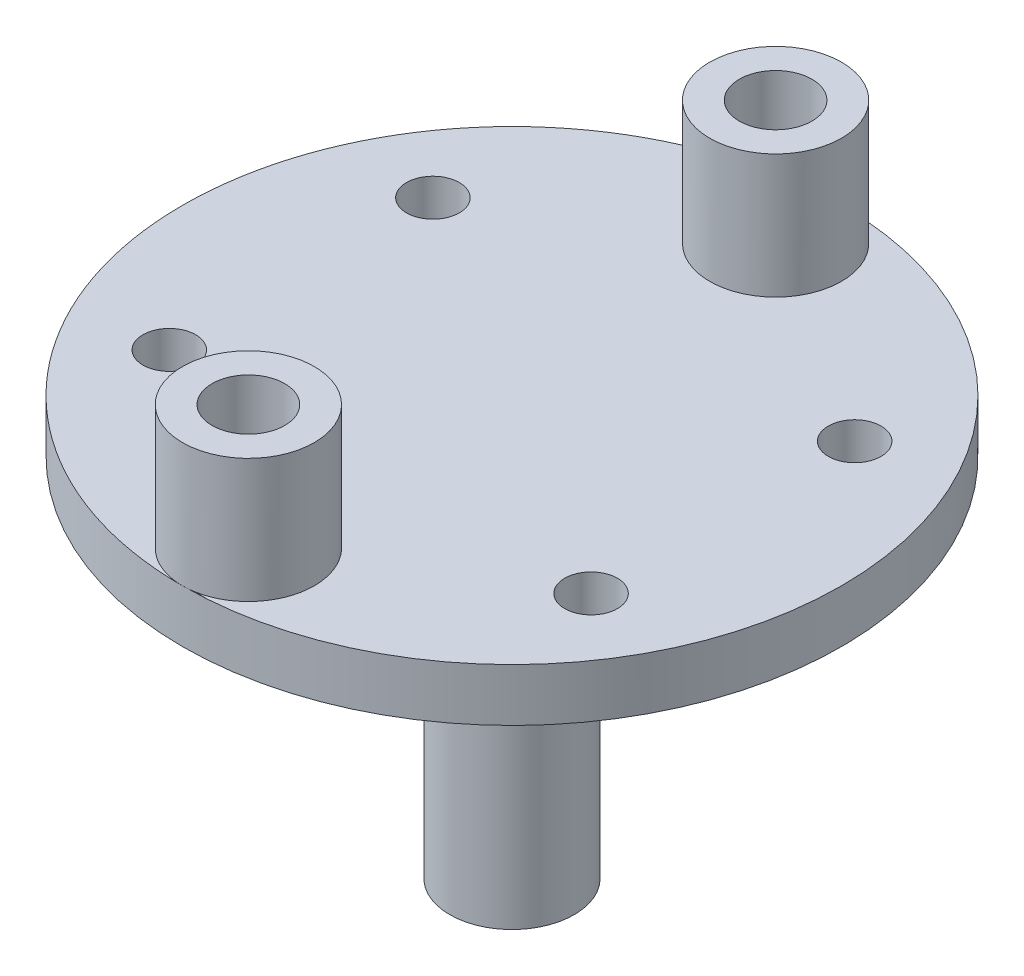
from build123d import *

# Parameters (mm, degrees)
SKETCH1_R           = 15.875
SKETCH1_R_2         = 1.75
SKETCH1_W           = 25.4
SKETCH1_H           = 17.78
SKETCH1_R_3         = 1.27
BOSS_EXTRUDE1_DEPTH = 2.54
SKETCH2_R           = 3.175
SKETCH2_R_2         = 1.75
BOSS_EXTRUDE2_DEPTH = 5.974999988
SKETCH3_R           = 3
BOSS_EXTRUDE3_DEPTH = 17.61998


with BuildPart() as part:
    # Sketch1 → Boss-Extrude1 (new body)
    # profile 1 of 2: a face of its own
    with BuildSketch(Plane(origin=(0, 0, 0), x_dir=(1, 0, 0), z_dir=(0, 1, 0))):
        with Locations(Location((12.7, 8.89, 0), (0, 0, 270))):
            Circle(SKETCH1_R)
        with Locations(Location((12.7, 21.59, 0), (0, 0, 270))):
            Circle(SKETCH1_R_2, mode=Mode.SUBTRACT)
        with Locations(Location((12.7, -3.81, 0), (0, 0, 270))):
            Circle(SKETCH1_R_2, mode=Mode.SUBTRACT)
        with Locations((12.7, 8.89)):
            Rectangle(SKETCH1_W, SKETCH1_H, mode=Mode.SUBTRACT)
    # profile 2 of 2: a face of its own
    with BuildSketch(Plane(origin=(0, 0, 0), x_dir=(1, 0, 0), z_dir=(0, 1, 0))):
        with Locations((12.7, 8.89)):
            Rectangle(SKETCH1_W, SKETCH1_H)
        with Locations(Location((22.86, 15.24, 0), (0, 0, 270))):
            Circle(SKETCH1_R_3, mode=Mode.SUBTRACT)
        with Locations(Location((2.54, 15.24, 0), (0, 0, 270))):
            Circle(SKETCH1_R_3, mode=Mode.SUBTRACT)
        with Locations(Location((22.86, 2.54, 0), (0, 0, 270))):
            Circle(SKETCH1_R_3, mode=Mode.SUBTRACT)
        with Locations(Location((2.54, 2.54, 0), (0, 0, 270))):
            Circle(SKETCH1_R_3, mode=Mode.SUBTRACT)
    extrude(amount=BOSS_EXTRUDE1_DEPTH)

    # Sketch2 → Boss-Extrude2 (add)
    # profile 1 of 2: a face of its own
    with BuildSketch(Plane(origin=(0, 2.54, 0), x_dir=(1, 0, 0), z_dir=(0, 1, 0))):
        with Locations(Location((12.7, 21.59, 0), (0, 0, 89.999491582))):
            Circle(SKETCH2_R)
        with Locations(Location((12.7, 21.59, 0), (0, 0, 270))):
            Circle(SKETCH2_R_2, mode=Mode.SUBTRACT)
    # profile 2 of 2: a face of its own
    with BuildSketch(Plane(origin=(0, 2.54, 0), x_dir=(1, 0, 0), z_dir=(0, 1, 0))):
        with Locations(Location((12.7, -3.81, 0), (0, 0, 269.999491581))):
            Circle(SKETCH2_R)
        with Locations(Location((12.7, -3.81, 0), (0, 0, 270))):
            Circle(SKETCH2_R_2, mode=Mode.SUBTRACT)
    extrude(amount=BOSS_EXTRUDE2_DEPTH)

    # Sketch3 → Boss-Extrude3 (add)
    with BuildSketch(Plane.XZ):
        with Locations(Location((12.7, -8.89, 0), (0, 0, 90))):
            Circle(SKETCH3_R)
    extrude(amount=BOSS_EXTRUDE3_DEPTH)


solid = part.part
